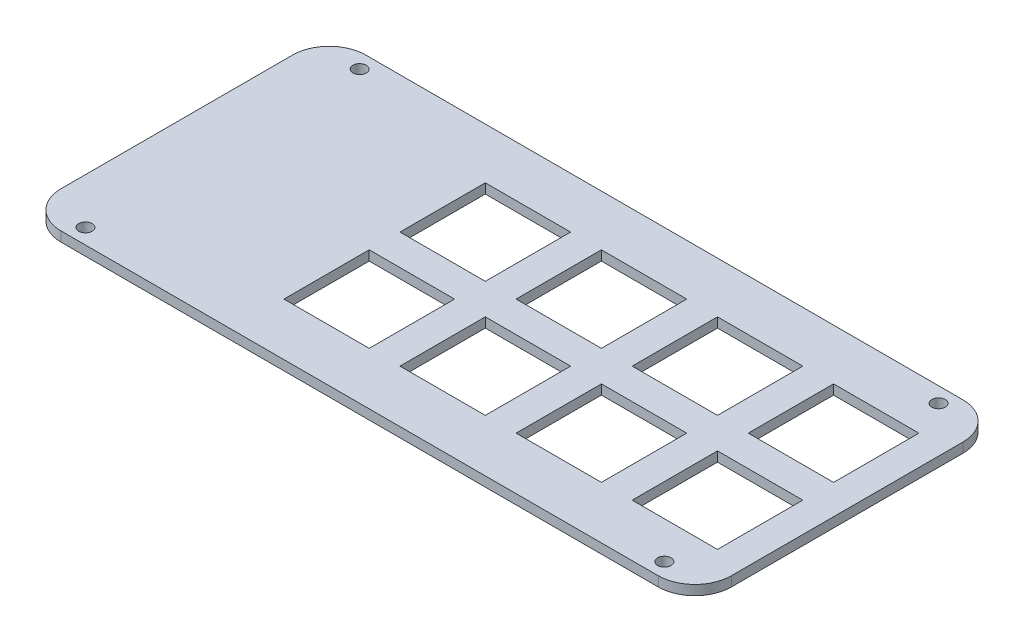
from build123d import *

# Parameters (mm, degrees)
SKIZZE1_R                       = 1.1
AUFSATZ_LINEAR_AUSTRAGEN1_DEPTH = 1.6
SKIZZE2_W                       = 14
SKIZZE2_H                       = 14
SCHNITT_LINEAR_AUSTRAGEN1_DEPTH = 61.436412865


with BuildPart() as part:
    # Skizze1 → Aufsatz-Linear austragen1 (new body)
    with BuildSketch(Plane(origin=(0, 0, 0), x_dir=(1, 0, 0), z_dir=(0, 1, 0))):
        with BuildLine():
            Line((-49, 25), (49, 25))
            ThreePointArc((49, 25), (53.242640687, 23.242640687), (55, 19))
            Line((55, 19), (55, -19))
            ThreePointArc((55, -19), (53.242640687, -23.242640687), (49, -25))
            Line((49, -25), (-49, -25))
            ThreePointArc((-49, -25), (-53.242640687, -23.242640687), (-55, -19))
            Line((-55, -19), (-55, 19))
            ThreePointArc((-55, 19), (-53.242640687, 23.242640687), (-49, 25))
        make_face()
        with Locations(Location((47.5, 22.5, 0), (0, 0, 270))):
            Circle(SKIZZE1_R, mode=Mode.SUBTRACT)
        with Locations(Location((-47.5, 22.5, 0), (0, 0, 270))):
            Circle(SKIZZE1_R, mode=Mode.SUBTRACT)
        with Locations(Location((47.5, -22.5, 0), (0, 0, 270))):
            Circle(SKIZZE1_R, mode=Mode.SUBTRACT)
        with Locations(Location((-47.5, -22.5, 0), (0, 0, 270))):
            Circle(SKIZZE1_R, mode=Mode.SUBTRACT)
    extrude(amount=AUFSATZ_LINEAR_AUSTRAGEN1_DEPTH)

    # Skizze2 → Schnitt-Linear austragen1 (cut, through all)
    with BuildSketch(Plane(origin=(0, 1.6, 0), x_dir=(1, 0, 0), z_dir=(0, 1, 0))):
        with Locations((43.12, 9.65)):
            Rectangle(SKIZZE2_W, SKIZZE2_H)
        with Locations((43.12, -9.4)):
            Rectangle(SKIZZE2_W, SKIZZE2_H)
        with Locations((24.07, -9.4)):
            Rectangle(SKIZZE2_W, SKIZZE2_H)
        with Locations((5.02, -9.4)):
            Rectangle(SKIZZE2_W, SKIZZE2_H)
        with Locations((-14.03, -9.4)):
            Rectangle(SKIZZE2_W, SKIZZE2_H)
        with Locations((24.07, 9.65)):
            Rectangle(SKIZZE2_W, SKIZZE2_H)
        with Locations((5.02, 9.65)):
            Rectangle(SKIZZE2_W, SKIZZE2_H)
        with Locations((-14.03, 9.65)):
            Rectangle(SKIZZE2_W, SKIZZE2_H)
    extrude(amount=-SCHNITT_LINEAR_AUSTRAGEN1_DEPTH, mode=Mode.SUBTRACT)


solid = part.part
